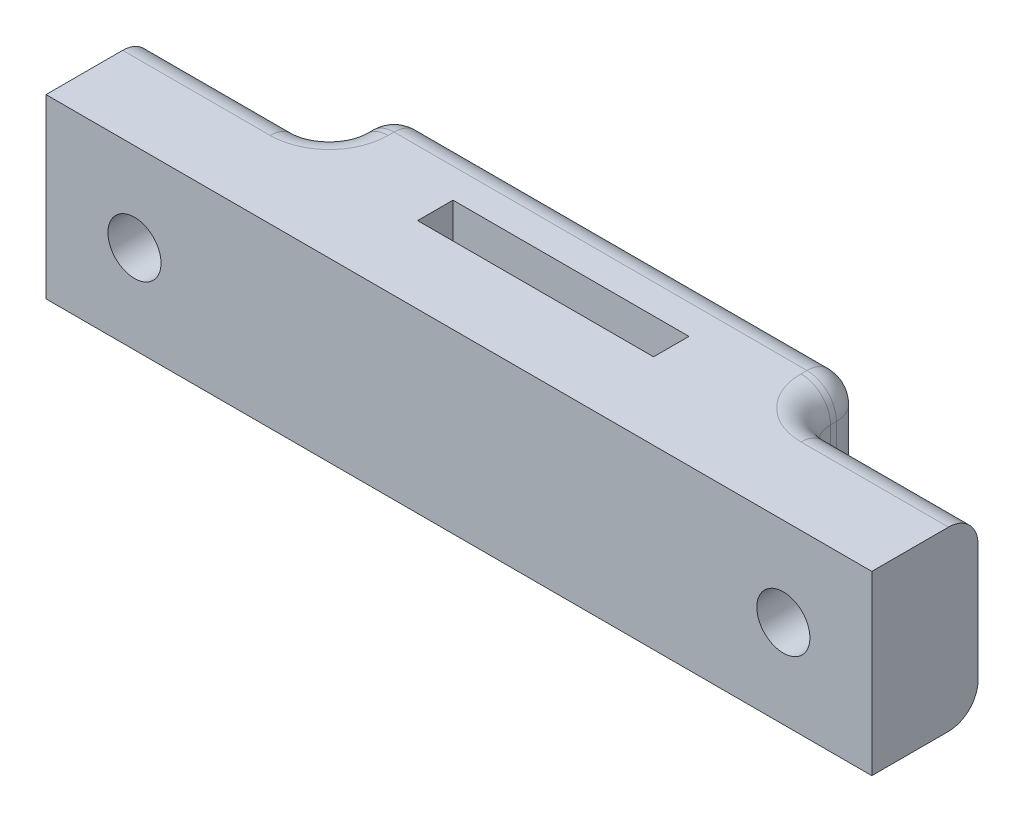
from build123d import *

# Parameters (mm, degrees)
SKETCH1_W                                           = 20
SKETCH1_H                                           = 3
BOSS_EXTRUDE1_DEPTH                                 = 15
CBORE_FOR_M4_HEX_SOCKET_HEAD_CAP_SCREW1_D           = 4.5
CBORE_FOR_M4_HEX_SOCKET_HEAD_CAP_SCREW1_CBORE_D     = 8
CBORE_FOR_M4_HEX_SOCKET_HEAD_CAP_SCREW1_CBORE_DEPTH = 4.4
FILLET1_R                                           = 2.5


with BuildPart() as part:
    # Sketch1 → Boss-Extrude1 (new body)
    with BuildSketch(Plane(origin=(0, 0, 0), x_dir=(1, 0, 0), z_dir=(0, 1, 0))):
        Polygon((-20, 6.5), (20, 6.5), (20, 1), (35, 1), (35, -8), (-35, -8), (-35, 1), (-20, 1), align=None)
        Rectangle(SKETCH1_W, SKETCH1_H, mode=Mode.SUBTRACT)
    extrude(amount=BOSS_EXTRUDE1_DEPTH)

    # CBORE for M4 Hex Socket Head Cap Screw1 (through all)
    with Locations(Plane(origin=(27.5, 7.5, -1), x_dir=(-1, 0, 0), z_dir=(0, 0, -1))):
        with Locations((0, 0), (55, 0)):
            CounterBoreHole(CBORE_FOR_M4_HEX_SOCKET_HEAD_CAP_SCREW1_D / 2, CBORE_FOR_M4_HEX_SOCKET_HEAD_CAP_SCREW1_CBORE_D / 2, CBORE_FOR_M4_HEX_SOCKET_HEAD_CAP_SCREW1_CBORE_DEPTH)

    # Fillet1
    fillet1_edges = [part.edges().sort_by_distance(p)[0] for p in [
        (-27.5, 0, -1),
        (-20, 0, -3.75),
        (-20, 7.5, -6.5),
        (20, 7.5, -6.5),
        (20, 7.5, -1),
        (-20, 7.5, -1),
        (27.5, 15, -1),
        (20, 15, -3.75),
        (0, 15, -6.5),
        (-20, 15, -3.75),
        (0, 0, -6.5),
        (-27.5, 15, -1),
        (20, 0, -3.75),
        (27.5, 0, -1),
    ]]
    fillet(fillet1_edges, radius=FILLET1_R)


solid = part.part
